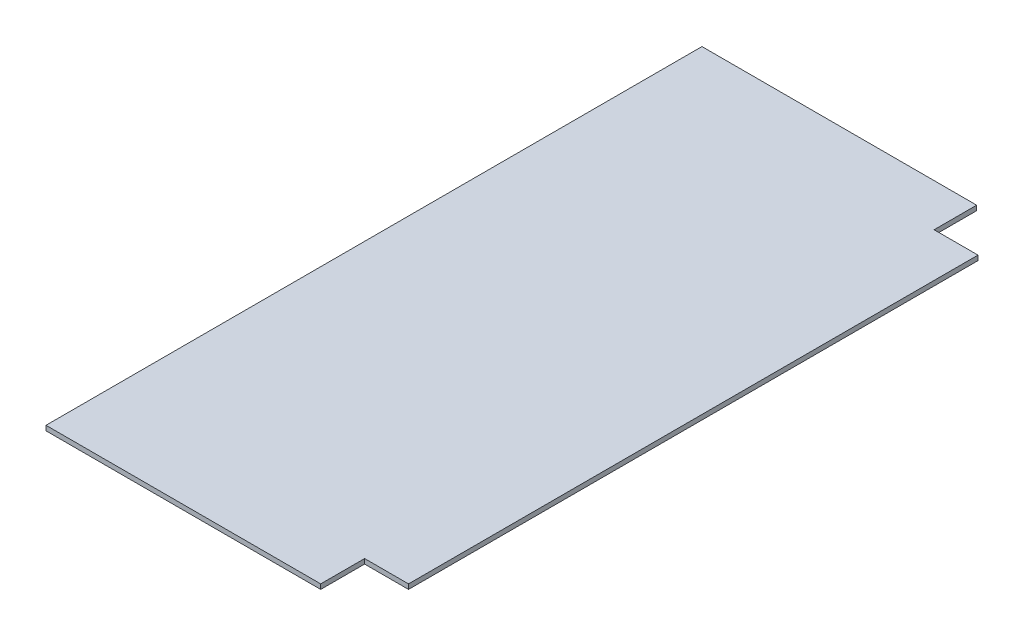
from build123d import *

# Parameters (mm, degrees)
BOSS_EXTRUDE1_DEPTH = 9
SKETCH2_W           = 14
SKETCH2_H           = 1225
CUT_EXTRUDE1_DEPTH  = 10
SKETCH3_W           = 82
SKETCH3_H           = 82
CUT_EXTRUDE2_DEPTH  = 10


with BuildPart() as part:
    # Sketch1 → Boss-Extrude1 (new body)
    with BuildSketch(Plane(origin=(0, 0, 0), x_dir=(1, 0, 0), z_dir=(0, 1, 0))):
        Polygon((-304.5, -532.5), (-304.5, -612.5), (224.5, -612.5), (304.5, -612.5), (304.5, -532.5), (304.5, 497.5), (304.5, 612.5), (224.5, 612.5), (-304.5, 612.5), (-304.5, 497.5), align=None)
    extrude(amount=BOSS_EXTRUDE1_DEPTH)

    # Sketch2 → Cut-Extrude1 (cut)
    with BuildSketch(Plane(origin=(0, 9, 0), x_dir=(1, 0, 0), z_dir=(0, 1, 0))):
        with Locations((-297.5, 0)):
            Rectangle(SKETCH2_W, SKETCH2_H)
    extrude(amount=-CUT_EXTRUDE1_DEPTH, mode=Mode.SUBTRACT)

    # Sketch3 → Cut-Extrude2 (cut)
    with BuildSketch(Plane(origin=(0, 9, 0), x_dir=(1, 0, 0), z_dir=(0, 1, 0))):
        with Locations((263.5, -571.5)):
            Rectangle(SKETCH3_W, SKETCH3_H)
        Polygon((304.5, 533), (222.5, 533), (222.5, 615), (304.5, 612.5), align=None)
    extrude(amount=-CUT_EXTRUDE2_DEPTH, mode=Mode.SUBTRACT)


solid = part.part
